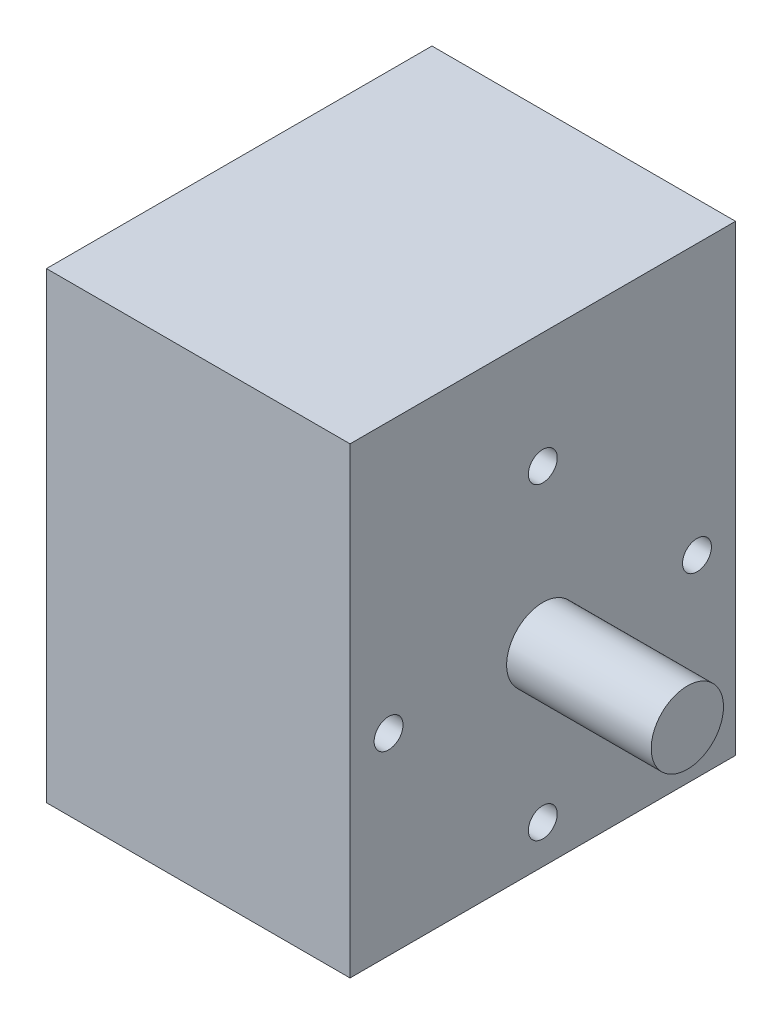
from build123d import *

# Parameters (mm, degrees)
SKETCH1_W           = 80
SKETCH1_H           = 96
SKETCH1_R           = 3
BOSS_EXTRUDE1_DEPTH = 63
SKETCH2_R           = 7.5
BOSS_EXTRUDE2_DEPTH = 30


with BuildPart() as part:
    # Sketch1 → Boss-Extrude1 (new body)
    with BuildSketch(Plane(origin=(0, 0, 0), x_dir=(0, 0, -1), z_dir=(1, 0, 0))):
        with Locations((0, 8)):
            Rectangle(SKETCH1_W, SKETCH1_H)
        with Locations((0, 32)):
            Circle(SKETCH1_R, mode=Mode.SUBTRACT)
        with Locations((-32, 0)):
            Circle(SKETCH1_R, mode=Mode.SUBTRACT)
        with Locations((0, -32)):
            Circle(SKETCH1_R, mode=Mode.SUBTRACT)
        with Locations((32, 0)):
            Circle(SKETCH1_R, mode=Mode.SUBTRACT)
    extrude(amount=-BOSS_EXTRUDE1_DEPTH)

    # Sketch2 → Boss-Extrude2 (add)
    with BuildSketch(Plane(origin=(0, 0, 0), x_dir=(0, 0, -1), z_dir=(1, 0, 0))):
        Circle(SKETCH2_R)
    extrude(amount=BOSS_EXTRUDE2_DEPTH)


solid = part.part
